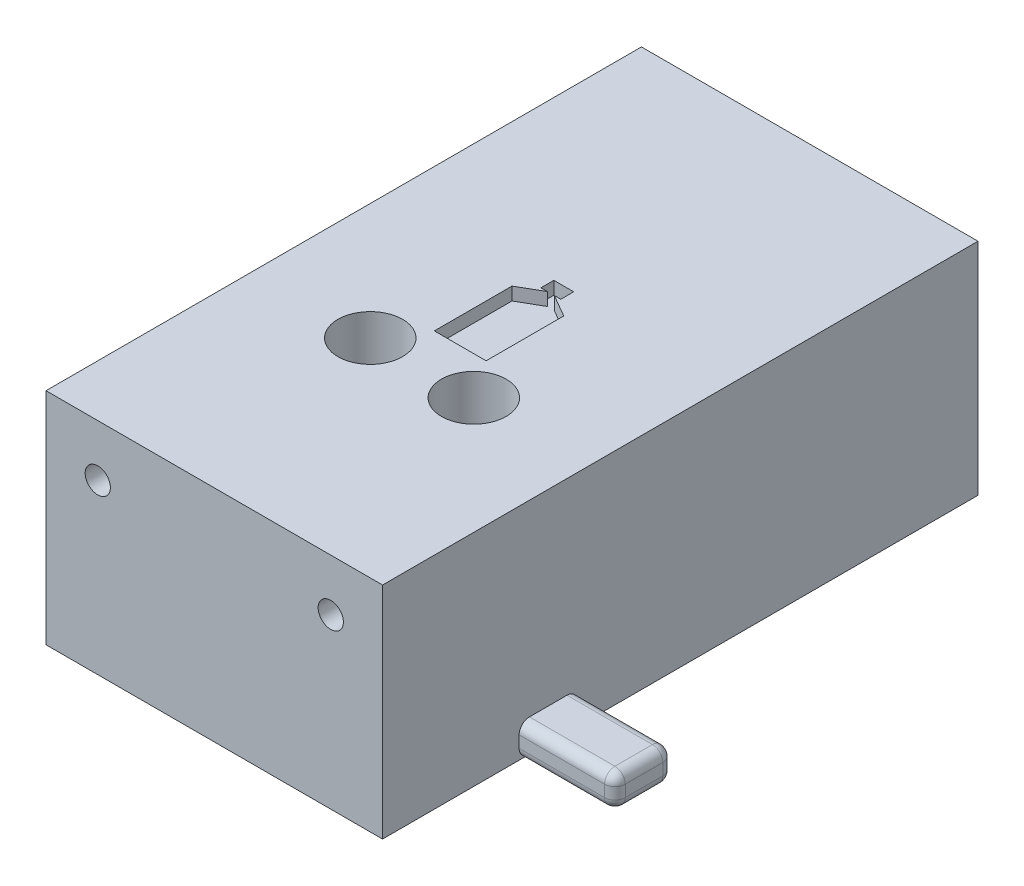
from build123d import *

# Parameters (mm, degrees)
SKETCH_1_W          = 26
SKETCH_1_H          = 17
EXTRUDE_1_DEPTH     = 46
SKETCH_2_W          = 4.5
SKETCH_2_H          = 2.5
EXTRUDE_2_DEPTH     = 7.4
SKETCH_4_W          = 5
SKETCH_4_H          = 3
EXTRUDE_3_DEPTH     = 7.4
SKETCH_5_R          = 1.2
CUT_EXTRUDE_1_DEPTH = 54.114593098
CUT_EXTRUDE_2_DEPTH = 1
SKETCH_8_R          = 2.5
CUT_EXTRUDE_3_DEPTH = 4
SKETCH_9_R          = 0.975
CUT_EXTRUDE_4_DEPTH = 5
FILLET_1_R          = 0.8


with BuildPart() as part:
    # ｽｹｯﾁ1 → ﾎﾞｽ - 押し出し1 (new body)
    with BuildSketch(Plane.XY):
        Rectangle(SKETCH_1_W, SKETCH_1_H)
    extrude(amount=-EXTRUDE_1_DEPTH)

    # ｽｹｯﾁ2 → ﾎﾞｽ - 押し出し2 (add)
    with BuildSketch(Plane(origin=(13, 0, 0), x_dir=(0, 0, -1), z_dir=(1, 0, 0))):
        with Locations((12.8, -7.25)):
            Rectangle(SKETCH_2_W, SKETCH_2_H)
    extrude(amount=EXTRUDE_2_DEPTH)

    # ｽｹｯﾁ4 → ﾎﾞｽ - 押し出し3 (add)
    with BuildSketch(Plane.ZY.offset(13)):
        with Locations((-12.8, -7)):
            Rectangle(SKETCH_4_W, SKETCH_4_H)
    extrude(amount=EXTRUDE_3_DEPTH)

    # ｽｹｯﾁ5 → ｶｯﾄ - 押し出し1 (cut, through all)
    with BuildSketch(Plane(origin=(0, 8.5, 0), x_dir=(1, 0, 0), z_dir=(0, 1, 0))):
        with Locations(Location((4, 16.05, 0), (0, 0, 180))):
            Circle(SKETCH_5_R)
        with Locations(Location((-4, 16.05, 0), (0, 0, 180))):
            Circle(SKETCH_5_R)
    extrude(amount=-CUT_EXTRUDE_1_DEPTH, mode=Mode.SUBTRACT)

    # ｽｹｯﾁ6 → ｶｯﾄ - 押し出し2 (cut)
    with BuildSketch(Plane(origin=(0, 8.5, 0), x_dir=(1, 0, 0), z_dir=(0, 1, 0))):
        Polygon((-2, 19), (2, 19), (2, 25), (0.267949192, 26), (0.767949192, 26), (0.767949192, 27), (-0.767949192, 27), (-0.767949192, 26), (-0.267949192, 26), (-2, 25), align=None)
    extrude(amount=-CUT_EXTRUDE_2_DEPTH, mode=Mode.SUBTRACT)

    # ｽｹｯﾁ8 → ｶｯﾄ - 押し出し3 (cut)
    with BuildSketch(Plane(origin=(0, 8.5, 0), x_dir=(1, 0, 0), z_dir=(0, 1, 0))):
        with Locations(Location((-4, 16.05, 0), (0, 0, 180))):
            Circle(SKETCH_8_R)
        with Locations(Location((4, 16.05, 0), (0, 0, 180))):
            Circle(SKETCH_8_R)
    extrude(amount=-CUT_EXTRUDE_3_DEPTH, mode=Mode.SUBTRACT)

    # ｽｹｯﾁ9 → ｶｯﾄ - 押し出し4 (cut)
    with BuildSketch(Plane.XY):
        with Locations((-9, 4.5)):
            Circle(SKETCH_9_R)
        with Locations(Location((9, 4.5, 0), (0, 0, 180))):
            Circle(SKETCH_9_R)
    extrude(amount=-CUT_EXTRUDE_4_DEPTH, mode=Mode.SUBTRACT)

    # ﾌｨﾚｯﾄ1
    fillet_1_edges = [part.edges().sort_by_distance(p)[0] for p in [
        (16.7, -6, -10.55),
        (16.7, -8.5, -10.55),
        (16.7, -8.5, -15.05),
        (16.7, -6, -15.05),
        (20.4, -7.25, -10.55),
        (20.4, -8.5, -12.8),
        (20.4, -7.25, -15.05),
        (20.4, -6, -12.8),
        (-16.7, -8.5, -10.3),
        (-16.7, -5.5, -10.3),
        (-16.7, -5.5, -15.3),
        (-16.7, -8.5, -15.3),
        (-20.4, -7, -10.3),
        (-20.4, -5.5, -12.8),
        (-20.4, -7, -15.3),
        (-20.4, -8.5, -12.8),
    ]]
    fillet(fillet_1_edges, radius=FILLET_1_R)


solid = part.part
